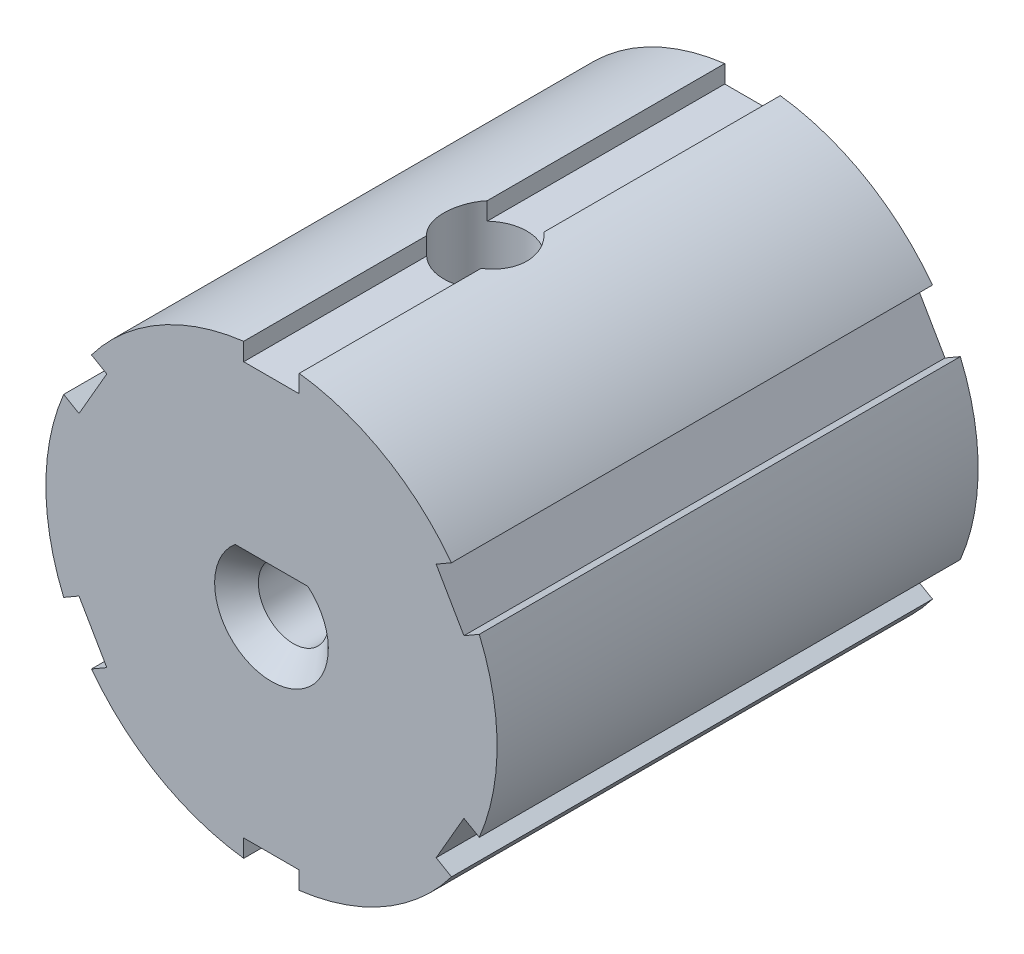
from build123d import *

# Parameters (mm, degrees)
EXTRUDE_1_DEPTH          = 22
SKETCH_2_R               = 8.75
CUT_EXTRUDE_1_DEPTH      = 9
CUT_EXTRUDE_3_DEPTH      = 1
CUT_EXTRUDE_3_DEPTH_BACK = 8.42975
SKETCH_4_R               = 1.9
CHAMFER_2_SIZE           = 1


with BuildPart() as part:
    # Эскиз1 → Бобышка-Вытянуть1 (new body)
    with BuildSketch(Plane.XY):
        with BuildLine():
            Line((13.201310027, -7.85542296), (13.90326512, -8.260696921))
            ThreePointArc((13.90326512, -8.260696921), (14.718656981, -4.240400213), (13.903265122, -0.220103504))
            Line((13.903265122, -0.220103504), (13.201310027, -0.625377467))
            Line((13.201310027, -0.625377467), (11.931310033, 1.574327047))
            Line((11.931310033, 1.574327047), (12.633265127, 1.979601009))
            ThreePointArc((12.633265127, 1.979601009), (9.559281984, 4.695899416), (5.669906988, 5.999897702))
            Line((5.669906988, 5.999897702), (5.669906988, 5.189349779))
            Line((5.669906988, 5.189349779), (3.129906988, 5.189349779))
            Line((3.129906988, 5.189349779), (3.129906988, 5.999897708))
            ThreePointArc((3.129906988, 5.999897708), (-0.759468012, 4.69589942), (-3.833451156, 1.979601011))
            Line((-3.833451156, 1.979601011), (-3.131496059, 1.574327046))
            Line((-3.131496059, 1.574327046), (-4.401496055, -0.625377472))
            Line((-4.401496055, -0.625377472), (-5.103451147, -0.22010351))
            ThreePointArc((-5.103451147, -0.22010351), (-5.918843009, -4.240400218), (-5.10345115, -8.260696926))
            Line((-5.10345115, -8.260696926), (-4.401496056, -7.855422963))
            Line((-4.401496056, -7.855422963), (-3.13149606, -10.055127481))
            Line((-3.13149606, -10.055127481), (-3.833451154, -10.460401444))
            ThreePointArc((-3.833451154, -10.460401444), (-0.759468012, -13.17669985), (3.129906983, -14.480698136))
            Line((3.129906983, -14.480698136), (3.129906983, -13.670150213))
            Line((3.129906983, -13.670150213), (5.669906983, -13.670150213))
            Line((5.669906983, -13.670150213), (5.669906983, -14.480698142))
            ThreePointArc((5.669906983, -14.480698142), (9.559281984, -13.176699854), (12.633265129, -10.460401443))
            Line((12.633265129, -10.460401443), (11.931310031, -10.055127478))
            Line((11.931310031, -10.055127478), (13.201310027, -7.85542296))
        make_face()
        with BuildLine():
            Line((3.15090739, -3.240400222), (5.64890659, -3.240400222))
            ThreePointArc((5.64890659, -3.240400222), (4.39990699, -5.840400222), (3.15090739, -3.240400222))
        make_face(mode=Mode.SUBTRACT)
    extrude(amount=EXTRUDE_1_DEPTH)

    # Эскиз2 → Вырез-Вытянуть1 (cut)
    with BuildSketch(Plane(origin=(0, 0, 0), x_dir=(-1, 0, 0), z_dir=(0, 0, -1))):
        with Locations((-4.39990699, -4.240400222)):
            Circle(SKETCH_2_R)
    extrude(amount=-CUT_EXTRUDE_1_DEPTH, mode=Mode.SUBTRACT)

    # Эскиз4 → Вырез-Вытянуть3 (cut, two sides: drawn at the far end of the back side and taken through both)
    with BuildSketch(Plane(origin=(0, 5.189349779, 0), x_dir=(1, 0, 0), z_dir=(0, 1, 0)).offset(-CUT_EXTRUDE_3_DEPTH_BACK)):
        with Locations(Location((4.428692677, -12.248697559, 0), (0, 0, 50.042601615))):
            Circle(SKETCH_4_R)
    extrude(amount=CUT_EXTRUDE_3_DEPTH + CUT_EXTRUDE_3_DEPTH_BACK, mode=Mode.SUBTRACT)

    # Фаска2
    chamfer_2_edges = [part.edges().sort_by_distance(p)[0] for p in [
        (4.39990699, -5.840400222, 22),
        (4.39990699, -3.240400222, 22),
        (4.39990699, -3.240400222, 9),
        (4.39990699, -5.840400222, 9),
    ]]
    chamfer(chamfer_2_edges, length=CHAMFER_2_SIZE)


solid = part.part
